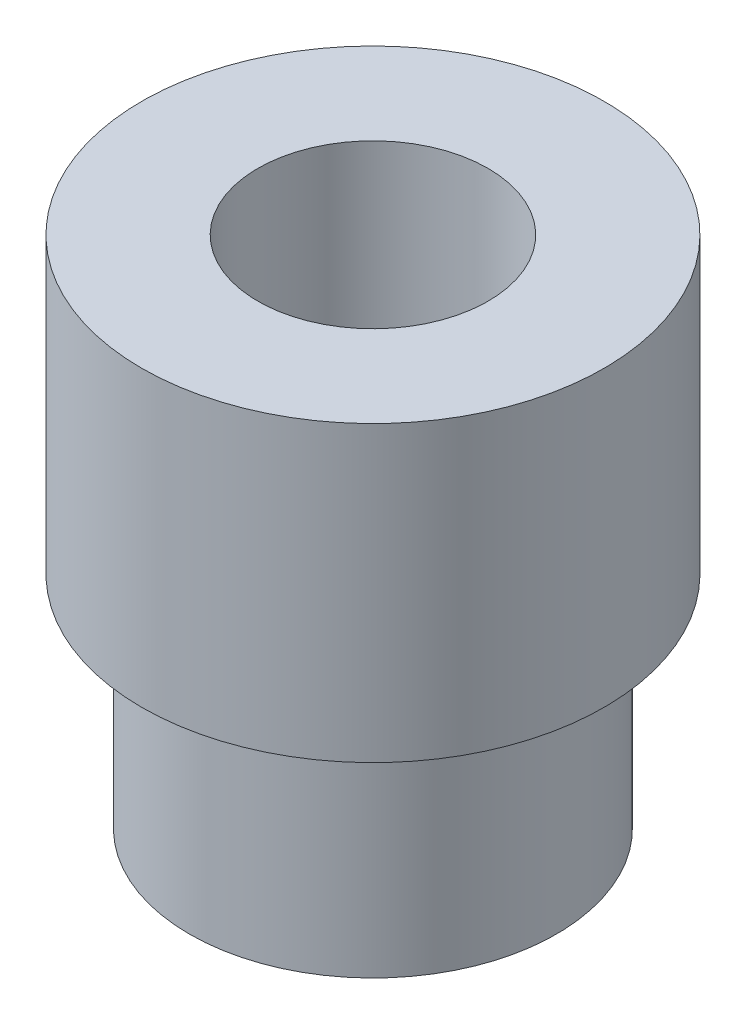
from build123d import *

# Parameters (mm, degrees)
SKETCH1_R              = 5
BEARING_COLLAR_DEPTH   = 6.35
SKETCH1_3_R            = 3.96875
CENTER_SPINDLE_DEPTH   = 4.7625
F_10_CLEARANCE_HOLE1_D = 4.9784


with BuildPart() as part:
    # Sketch1 → Bearing Collar (new body)
    with BuildSketch(Plane(origin=(0, 0, 0), x_dir=(1, 0, 0), z_dir=(0, 1, 0))):
        Circle(SKETCH1_R)
    extrude(amount=BEARING_COLLAR_DEPTH)

    # Sketch1<3> → Center Spindle (add)
    with BuildSketch(Plane(origin=(0, 0, 0), x_dir=(1, 0, 0), z_dir=(0, 1, 0))):
        Circle(SKETCH1_3_R)
    extrude(amount=-CENTER_SPINDLE_DEPTH)

    # #10 Clearance Hole1 (through all)
    with Locations(Plane(origin=(0, -4.7625, 0), x_dir=(0, 0, -1), z_dir=(0, -1, 0))):
        with Locations((0, 0)):
            Hole(F_10_CLEARANCE_HOLE1_D / 2)


solid = part.part
